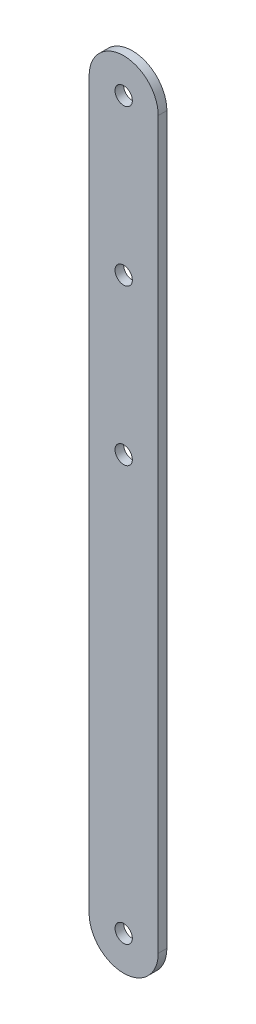
from build123d import *

# Parameters (mm, degrees)
SKETCH1_R           = 12.7
BOSS_EXTRUDE1_DEPTH = 12.7


with BuildPart() as part:
    # Sketch1 → Boss-Extrude1 (new body)
    with BuildSketch(Plane.XY):
        with BuildLine():
            Line((-50.8, -1066.8), (-50.8, 0))
            ThreePointArc((-50.8, 0), (0, 50.8), (50.8, 0))
            Line((50.8, 0), (50.8, -1066.8))
            ThreePointArc((50.8, -1066.8), (0, -1117.6), (-50.8, -1066.8))
        make_face()
        Circle(SKETCH1_R, mode=Mode.SUBTRACT)
        with Locations((0, -1066.8)):
            Circle(SKETCH1_R, mode=Mode.SUBTRACT)
        with Locations((0, -228.6)):
            Circle(SKETCH1_R, mode=Mode.SUBTRACT)
        with Locations((0, -457.2)):
            Circle(SKETCH1_R, mode=Mode.SUBTRACT)
    extrude(amount=BOSS_EXTRUDE1_DEPTH)


solid = part.part
